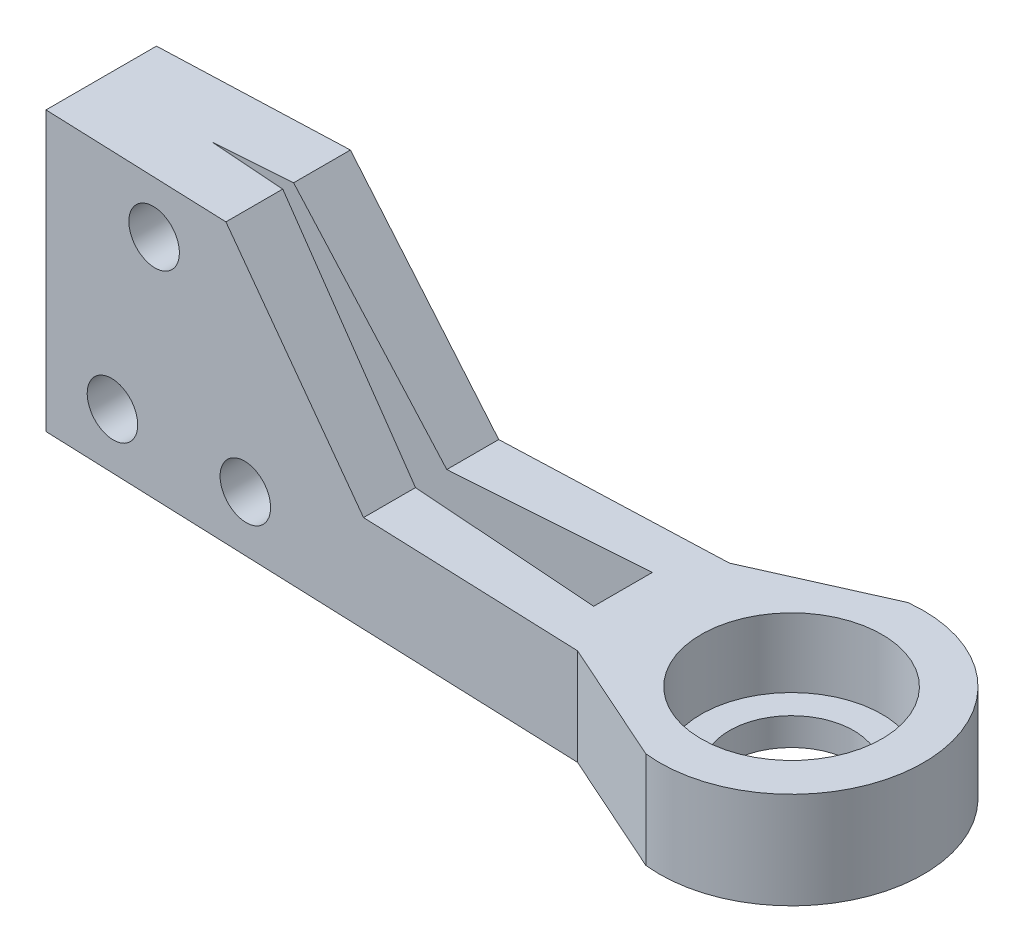
from build123d import *

# Parameters (mm, degrees)
SKETCH8_R                       = 4.5
BOSS_EXTRUDE2_DEPTH             = 7
SKETCH10_R                      = 6.55
CUT_EXTRUDE6_DEPTH              = 5
CUT_EXTRUDE7_DEPTH              = 10
CUT_EXTRUDE7_DEPTH_BACK         = 10
SKETCH11_R                      = 1.9
BOSS_EXTRUDE3_REACH             = 62.716
SKETCH12_R                      = 1.9
BOSS_EXTRUDE3_DIRECTION_2_REACH = 62.716
CUT_EXTRUDE8_REACH              = 65.597


with BuildPart() as part:
    # Sketch8 → Boss-Extrude2 (new body)
    with BuildSketch(Plane(origin=(0, 0, 0), x_dir=(1, 0, 0), z_dir=(0, 1, 0))):
        with BuildLine():
            Line((40, -5.5), (48.935186127, -9.490451592))
            ThreePointArc((48.935186127, -9.490451592), (59.55, 0), (48.935186127, 9.490451592))
            Line((48.935186127, 9.490451592), (40, 5.5))
            Line((40, 5.5), (0, 4))
            Line((0, 4), (0, -4))
            Line((0, -4), (40, -5.5))
        make_face()
        with Locations(Location((50, 0, 0), (0, 0, 270))):
            Circle(SKETCH8_R, mode=Mode.SUBTRACT)
    extrude(amount=BOSS_EXTRUDE2_DEPTH)

    # Sketch10 → Cut-Extrude6 (cut)
    with BuildSketch(Plane(origin=(0, 7, 0), x_dir=(1, 0, 0), z_dir=(0, 1, 0))):
        with Locations(Location((50, 0, 0), (0, 0, 270))):
            Circle(SKETCH10_R)
    extrude(amount=-CUT_EXTRUDE6_DEPTH, mode=Mode.SUBTRACT)

    # Sketch11 → Cut-Extrude7 (cut, two sides: drawn at the far end of the back side and taken through both)
    with BuildSketch(Plane.XY.offset(-CUT_EXTRUDE7_DEPTH_BACK)):
        with Locations(Location((5, 4, 0), (0, 0, 180))):
            Circle(SKETCH11_R)
        with Locations(Location((15, 4, 0), (0, 0, 180))):
            Circle(SKETCH11_R)
    extrude(amount=CUT_EXTRUDE7_DEPTH + CUT_EXTRUDE7_DEPTH_BACK, mode=Mode.SUBTRACT)

    # Boss-Extrude3: up to this plane
    boss_extrude3_end = Plane(origin=(-0.149789359, 7, 3.994382899), z_dir=(0.037473660589094265, 0, -0.9992976157091807))
    # Sketch12 → Boss-Extrude3 (add, up to the surface)
    with BuildSketch(Plane.XY, mode=Mode.PRIVATE) as boss_extrude3_sk1:
        Polygon((23.894935943, 7), (13.540419669, 20.177956538), (0, 20.177956538), (0, 7), align=None)
        with Locations(Location((8.136364364, 16.418485591, 0), (0, 0, 180))):
            Circle(SKETCH12_R, mode=Mode.SUBTRACT)
    boss_extrude3_tool1 = split(extrude(boss_extrude3_sk1.sketch, amount=BOSS_EXTRUDE3_REACH, mode=Mode.PRIVATE), bisect_by=boss_extrude3_end, keep=Keep.BOTH, mode=Mode.PRIVATE)
    add(boss_extrude3_tool1.solids().sort_by_distance((9.667927, 12.815835, 0))[0])

    # Boss-Extrude3 direction 2: up to this plane
    boss_extrude3_direction_2_end = Plane(origin=(-0.149789359, 7, -3.994382899), z_dir=(-0.037473660589094265, 0, -0.9992976157091807))
    # Sketch12 → Boss-Extrude3 direction 2 (add, up to the surface)
    with BuildSketch(Plane.XY, mode=Mode.PRIVATE) as boss_extrude3_direction_2_sk1:
        Polygon((23.894935943, 7), (13.540419669, 20.177956538), (0, 20.177956538), (0, 7), align=None)
        with Locations(Location((8.136364364, 16.418485591, 0), (0, 0, 180))):
            Circle(SKETCH12_R, mode=Mode.SUBTRACT)
    boss_extrude3_direction_2_tool1 = split(extrude(boss_extrude3_direction_2_sk1.sketch, amount=-BOSS_EXTRUDE3_DIRECTION_2_REACH, mode=Mode.PRIVATE), bisect_by=boss_extrude3_direction_2_end, keep=Keep.BOTH, mode=Mode.PRIVATE)
    add(boss_extrude3_direction_2_tool1.solids().sort_by_distance((9.667927, 12.815835, 0))[0])

    # Cut-Extrude8: up to this face of the body (flat: up to its plane)
    cut_extrude8_end = Plane(part.part.faces().sort_by_distance((6.904897785, 20.177956538, 0))[0])
    # Sketch13 → Cut-Extrude8 (cut, up to the picked face)
    with BuildSketch(Plane(origin=(0, 0, 0), x_dir=(1, 0, 0), z_dir=(0, 1, 0)), mode=Mode.PRIVATE) as cut_extrude8_sk1:
        Polygon((8.018762989, 0), (37.792949753, 2.126727626), (37.792949753, -2.126727626), align=None)
    cut_extrude8_tool1 = split(extrude(cut_extrude8_sk1.sketch, amount=CUT_EXTRUDE8_REACH, mode=Mode.PRIVATE), bisect_by=cut_extrude8_end, keep=Keep.BOTH, mode=Mode.PRIVATE)
    add(cut_extrude8_tool1.solids().sort_by(Axis((27.868221, 0, 0), (0, 1, 0)))[0], mode=Mode.SUBTRACT)


solid = part.part
